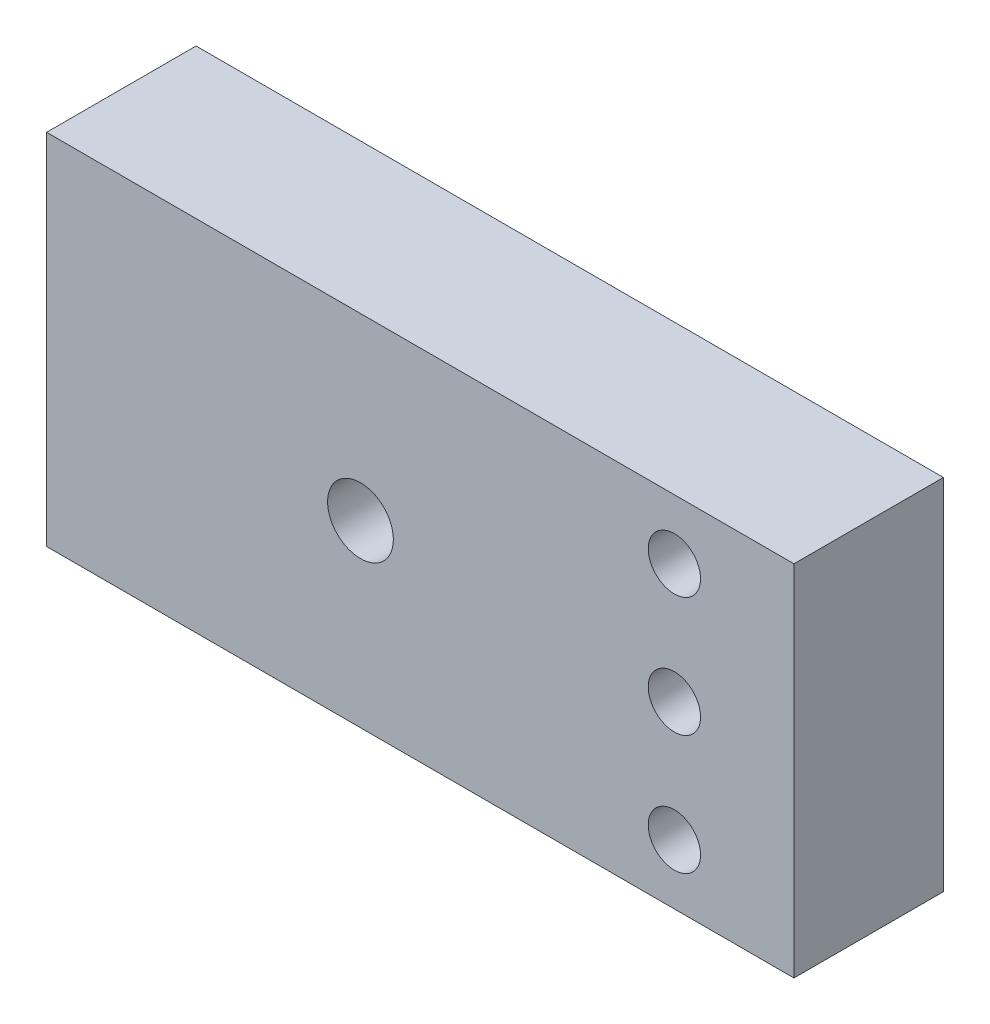
from build123d import *

# Parameters (mm, degrees)
SKETCH1_W                  = 250
SKETCH1_H                  = 120
BOSS_EXTRUDE1_DEPTH        = 50
F_22_0_22_DIAMETER_HOLE1_D = 22
M20_TAPPED_HOLE1_D         = 17.5
LPATTERN1_COUNT            = 2
LPATTERN1_PITCH            = 40
LPATTERN1_COL_COUNT        = 2
LPATTERN1_COL_PITCH        = 40


with BuildPart() as part:
    # Sketch1 → Boss-Extrude1 (new body)
    with BuildSketch(Plane.XY):
        Rectangle(SKETCH1_W, SKETCH1_H)
    extrude(amount=-BOSS_EXTRUDE1_DEPTH)

    # Ø22.0 (22) Diameter Hole1 (through all)
    with Locations(Plane.XY):
        with Locations((-20, 0)):
            Hole(F_22_0_22_DIAMETER_HOLE1_D / 2)

    # M20 Tapped Hole1 (through all)
    with Locations(Plane.XY):
        with Locations((85, 0)):
            m20_tapped_hole1 = Hole(M20_TAPPED_HOLE1_D / 2)

    # LPattern1: M20 Tapped Hole1 ×2
    with Locations(*[(0, -i * LPATTERN1_PITCH, 0) for i in range(1, LPATTERN1_COUNT)]):
        add(m20_tapped_hole1, mode=Mode.SUBTRACT)

    # LPattern1 col: M20 Tapped Hole1 ×2
    with Locations(*[(0, i * LPATTERN1_COL_PITCH, 0) for i in range(1, LPATTERN1_COL_COUNT)]):
        add(m20_tapped_hole1, mode=Mode.SUBTRACT)


solid = part.part
